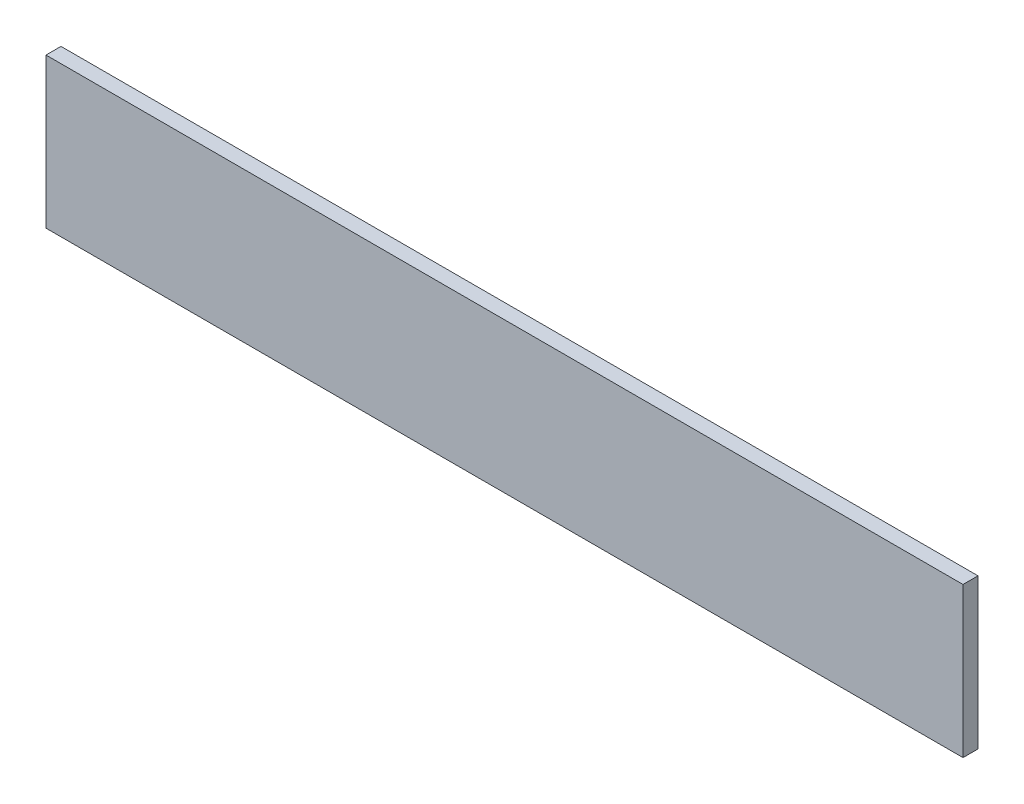
from build123d import *

# Parameters (mm, degrees)
SKETCH_1_W      = 6115
SKETCH_1_H      = 1000
EXTRUDE_1_DEPTH = 100


with BuildPart() as part:
    # Эскиз1 → Бобышка-Вытянуть1 (new body)
    with BuildSketch(Plane.XY):
        with Locations((3057.5, -500)):
            Rectangle(SKETCH_1_W, SKETCH_1_H)
    extrude(amount=EXTRUDE_1_DEPTH)


solid = part.part
